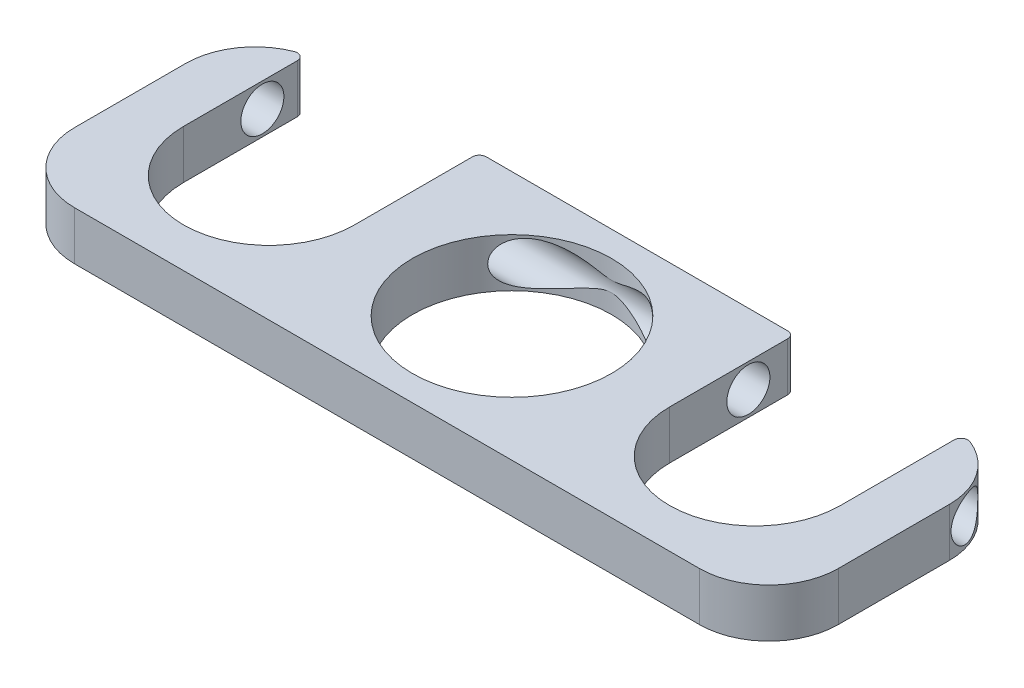
from build123d import *

# Parameters (mm, degrees)
SKETCH1_R               = 14.35
BOSS_EXTRUDE1_DEPTH     = 7
CUT_EXTRUDE1_DEPTH      = 10
CUT_EXTRUDE2_DEPTH      = 81.06428667
CUT_EXTRUDE2_DEPTH_BACK = 81.06428667
SKETCH3_R               = 3.1
FILLET2_R               = 1
FILLET3_R               = 1
FILLET5_R               = 1
FILLET7_R               = 1


with BuildPart() as part:
    # Sketch1 → Boss-Extrude1 (new body)
    with BuildSketch(Plane(origin=(0, 0, 0), x_dir=(1, 0, 0), z_dir=(0, 1, 0))):
        with BuildLine():
            Line((-45, -18), (45, -18))
            ThreePointArc((45, -18), (52.071067812, -15.071067812), (55, -8))
            Line((55, -8), (55, 8))
            ThreePointArc((55, 8), (52.071067812, 15.071067812), (45, 18))
            Line((45, 18), (-45, 18))
            ThreePointArc((-45, 18), (-52.071067812, 15.071067812), (-55, 8))
            Line((-55, 8), (-55, -8))
            ThreePointArc((-55, -8), (-52.071067812, -15.071067812), (-45, -18))
        make_face()
        with Locations(Location((0, 0, 0), (0, 0, 270))):
            Circle(SKETCH1_R, mode=Mode.SUBTRACT)
    extrude(amount=BOSS_EXTRUDE1_DEPTH)

    # Sketch2 → Cut-Extrude1 (cut)
    with BuildSketch(Plane(origin=(0, 7, 0), x_dir=(1, 0, 0), z_dir=(0, 1, 0))):
        with BuildLine():
            Line((-22.7, 0), (-22.7, 18))
            Line((-22.7, 18), (-47.3, 18))
            Line((-47.3, 18), (-47.3, 0))
            ThreePointArc((-47.3, 0), (-35, -12.3), (-22.7, 0))
        make_face()
    cut_extrude1 = extrude(amount=-CUT_EXTRUDE1_DEPTH, mode=Mode.SUBTRACT)

    # Sketch3 → Cut-Extrude2 (cut, two sides: drawn at the far end of the back side and taken through both)
    with BuildSketch(Plane.ZY.offset(22.7).offset(-CUT_EXTRUDE2_DEPTH_BACK)):
        with Locations((-11.34873736, 3.5)):
            Circle(SKETCH3_R)
    extrude(amount=CUT_EXTRUDE2_DEPTH + CUT_EXTRUDE2_DEPTH_BACK, mode=Mode.SUBTRACT)

    # Fillet2
    fillet2_edges = [part.edges().sort_by_distance(p)[0] for p in [
        (-47.3, 3.5, -17.731906288),
    ]]
    fillet(fillet2_edges, radius=FILLET2_R)

    # Fillet3
    fillet3_edges = [part.edges().sort_by_distance(p)[0] for p in [
        (-22.7, 3.5, -18),
    ]]
    fillet(fillet3_edges, radius=FILLET3_R)

    # Mirror5: Cut-Extrude1 across plane
    add(cut_extrude1.mirror(Plane.ZY), mode=Mode.SUBTRACT)

    # Fillet5
    fillet5_edges = [part.edges().sort_by_distance(p)[0] for p in [
        (47.3, 3.5, -17.731906288),
    ]]
    fillet(fillet5_edges, radius=FILLET5_R)

    # Fillet7
    fillet7_edges = [part.edges().sort_by_distance(p)[0] for p in [
        (22.7, 3.5, -18),
    ]]
    fillet(fillet7_edges, radius=FILLET7_R)


solid = part.part
